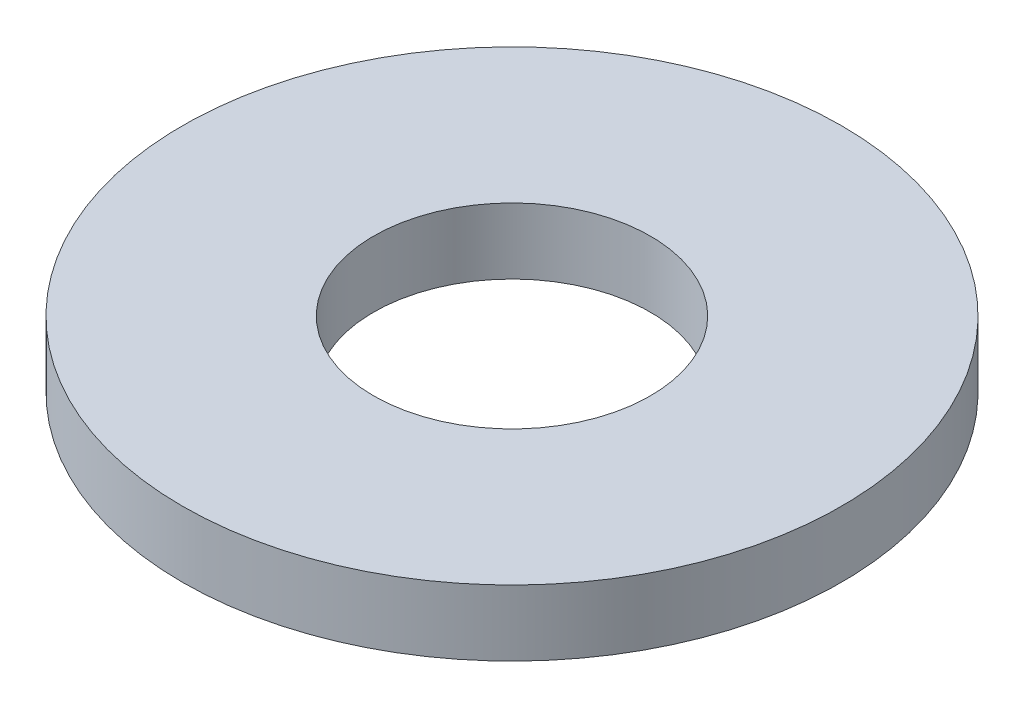
from build123d import *

# Parameters (mm, degrees)
CROQUIS1_R              = 5
SALIENTE_EXTRUIR1_DEPTH = 1
CROQUIS2_R              = 2.1
CORTAR_EXTRUIR1_DEPTH   = 8.141428429


with BuildPart() as part:
    # Croquis1 → Saliente-Extruir1 (new body)
    with BuildSketch(Plane(origin=(0, 0, 0), x_dir=(1, 0, 0), z_dir=(0, 1, 0))):
        with Locations(Location((0, 0, 0), (0, 0, 270))):
            Circle(CROQUIS1_R)
    extrude(amount=SALIENTE_EXTRUIR1_DEPTH)

    # Croquis2 → Cortar-Extruir1 (cut, through all)
    with BuildSketch(Plane(origin=(0, 1, 0), x_dir=(1, 0, 0), z_dir=(0, 1, 0))):
        with Locations(Location((0, 0, 0), (0, 0, 270))):
            Circle(CROQUIS2_R)
    extrude(amount=-CORTAR_EXTRUIR1_DEPTH, mode=Mode.SUBTRACT)


solid = part.part
